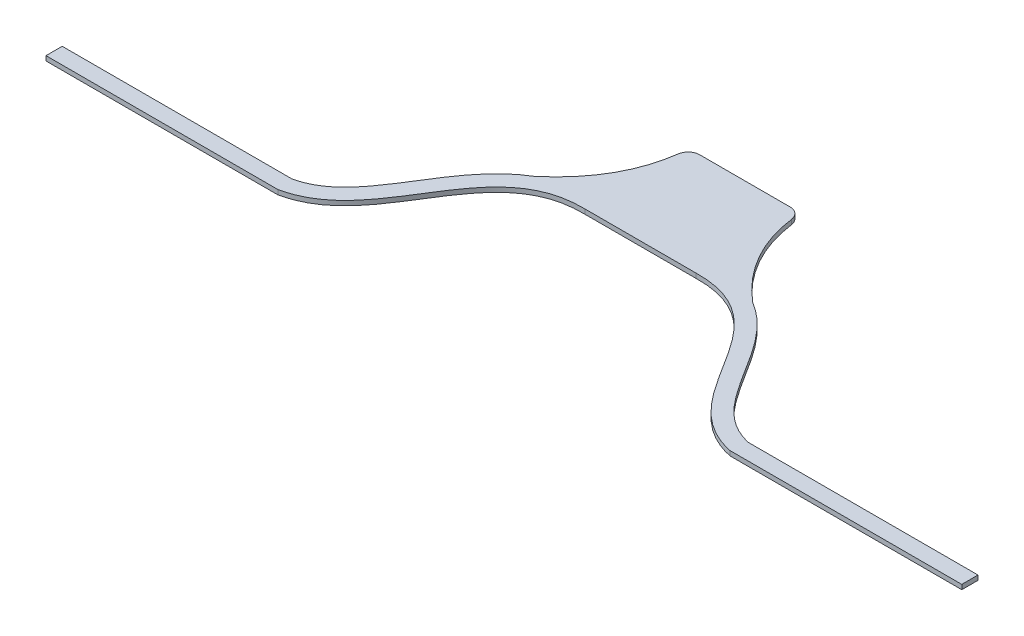
from build123d import *

# Parameters (mm, degrees)
BOSS_EXTRUDE1_DEPTH = 2


with BuildPart() as part:
    # Sketch1 → Boss-Extrude1 (new body)
    with BuildSketch(Plane(origin=(0, 0, 0), x_dir=(1, 0, 0), z_dir=(0, 1, 0))):
        with BuildLine():
            Line((24, 0), (48, 0))
            add(Edge.make_bspline(
                [(48, 0), (89.099365724, 0.874773385), (86.374059044, -51.603142983), (121.547837425, -58.986384407)],
                knots=[0, 0, 0, 0, 1, 1, 1, 1], degree=3))
            Line((121.547837425, -58.986384407), (221.547837425, -58.986384407))
            Line((221.547837425, -58.986384407), (221.547837425, -51.986384407))
            Line((221.547837425, -51.986384407), (122.313023704, -51.986384407))
            add(Edge.make_bspline(
                [(71.125998731, 1.232568174), (72.898809563, 0.181682333), (76.459813959, -2.315666191), (81.189700312, -6.726275017), (86.891376041, -13.416403627), (92.807836153, -22.347568969), (98.129903366, -31.060917059), (102.469737091, -37.345221684), (105.842818581, -41.580534372), (109.401004038, -45.224982649), (112.577237242, -47.710854013), (115.306225207, -49.358382328), (117.470523961, -50.422439309), (119.399803514, -51.164246751), (121.027397151, -51.664895321), (121.885844483, -51.886407758), (122.313023704, -51.986384407)],
                knots=[0.193856357, 0.193856357, 0.193856357, 0.193856357, 0.248016758, 0.310020948, 0.372025138, 0.496033517, 0.620041896, 0.682046086, 0.744050275, 0.806054465, 0.868058655, 0.899060749, 0.930062844, 0.961064939, 0.976565986, 0.992067034, 0.992067034, 0.992067034, 0.992067034], degree=3))
            add(Edge.make_bspline(
                [(48.443659708, 40.664433584), (50.620366821, 24.429534749), (58.981751845, 11.448277847), (71.125998731, 1.232568174)],
                knots=[0.080375853, 0.080375853, 0.080375853, 0.080375853, 1, 1, 1, 1], degree=3))
            ThreePointArc((48.443659708, 40.664433584), (46.780254452, 43.763121571), (43.488003544, 45))
            Line((43.488003544, 45), (24, 45))
            Line((24, 45), (24, 0))
        make_face()
    boss_extrude1 = extrude(amount=BOSS_EXTRUDE1_DEPTH)

    # Mirror1: Boss-Extrude1 across plane
    add(boss_extrude1.mirror(Plane(origin=(24, 2, -45), x_dir=(0, 0, 1), z_dir=(1, 0, 0))))


solid = part.part
